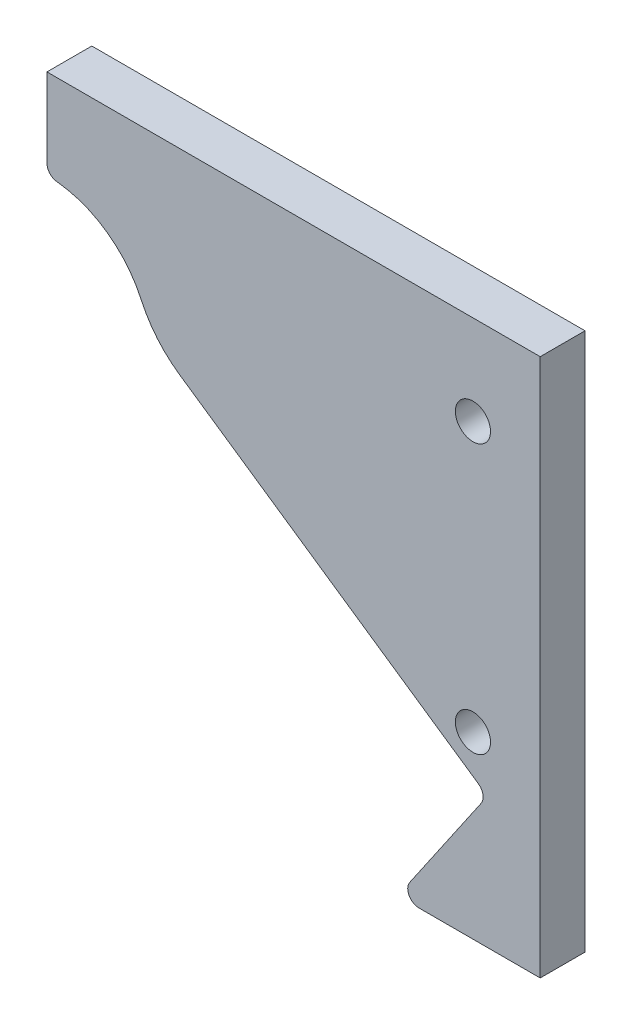
from build123d import *

# Parameters (mm, degrees)
SKETCH1_R           = 2.4892
BOSS_EXTRUDE1_DEPTH = 3.175
FILLET1_R           = 1.5875


with BuildPart() as part:
    # Sketch1 → Boss-Extrude1 (new, symmetric)
    with BuildSketch(Plane.XY):
        with BuildLine():
            ThreePointArc((18.812153865, -0.385081668), (15.640023815, 2.489031981), (13.351109218, 6.106186705))
            ThreePointArc((13.351109218, 6.106186705), (7.933835302, 12.352809027), (0, 14.6812))
            Line((0, 14.6812), (0, 27.3812))
            Line((0, 27.3812), (69.85, 27.3812))
            Line((69.85, 27.3812), (69.85, -48.8188))
            Line((69.85, -48.8188), (49.664583845, -48.8188))
            Line((49.664583845, -48.8188), (62.388915679, -30.256239225))
            Line((62.388915679, -30.256239225), (18.812153865, -0.385081668))
        make_face()
        with Locations((60.325, -23.4188)):
            Circle(SKETCH1_R, mode=Mode.SUBTRACT)
        with Locations((60.325, 14.6812)):
            Circle(SKETCH1_R, mode=Mode.SUBTRACT)
    extrude(amount=BOSS_EXTRUDE1_DEPTH, both=True)

    # Fillet1
    fillet1_edges = [part.edges().sort_by_distance(p)[0] for p in [
        (0, 14.6812, 0),
        (49.664583845, -48.8188, 0),
        (62.388915679, -30.256239225, 0),
    ]]
    fillet(fillet1_edges, radius=FILLET1_R)


solid = part.part
